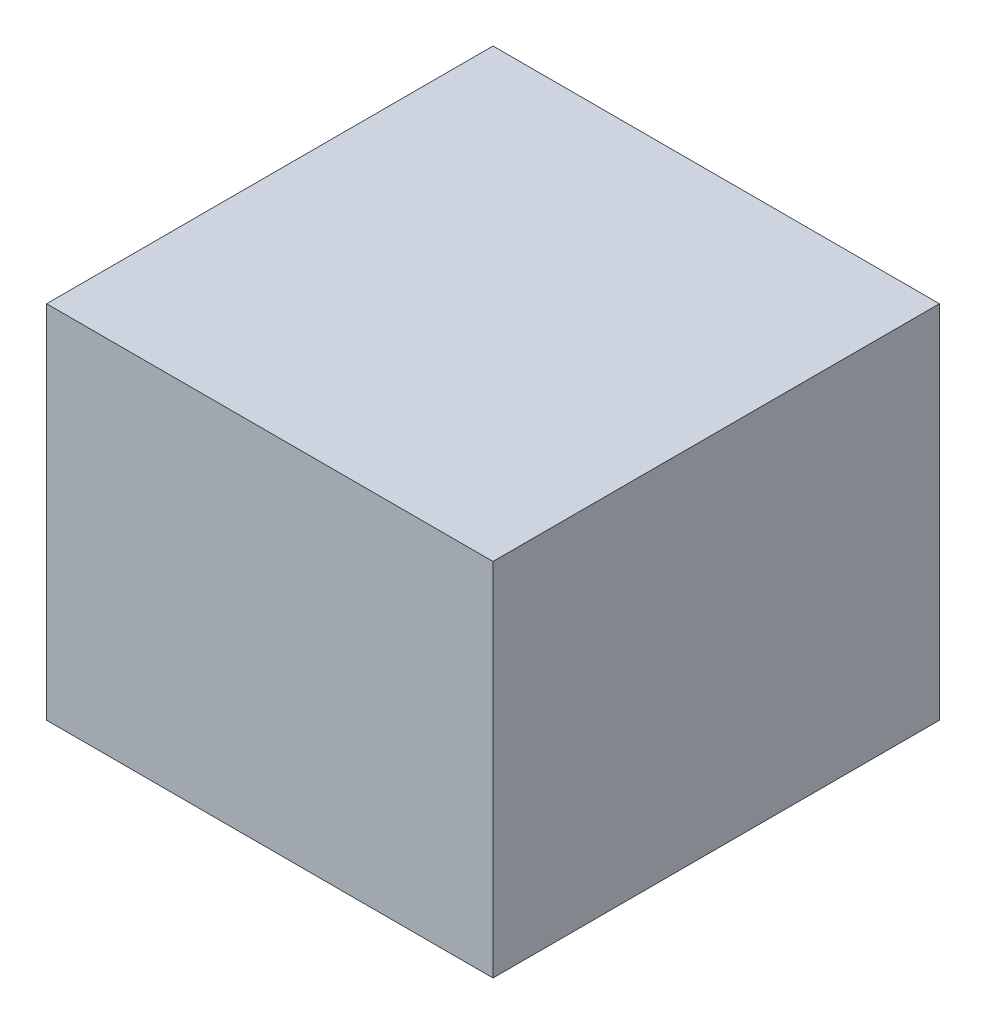
from build123d import *

# Parameters (mm, degrees)
SKETCH1_W           = 49.5
SKETCH1_H           = 49.5
BOSS_EXTRUDE1_DEPTH = 40


with BuildPart() as part:
    # Sketch1 → Boss-Extrude1 (new body)
    with BuildSketch(Plane(origin=(0, 0, 0), x_dir=(1, 0, 0), z_dir=(0, 1, 0))):
        Rectangle(SKETCH1_W, SKETCH1_H)
    extrude(amount=BOSS_EXTRUDE1_DEPTH)


solid = part.part
